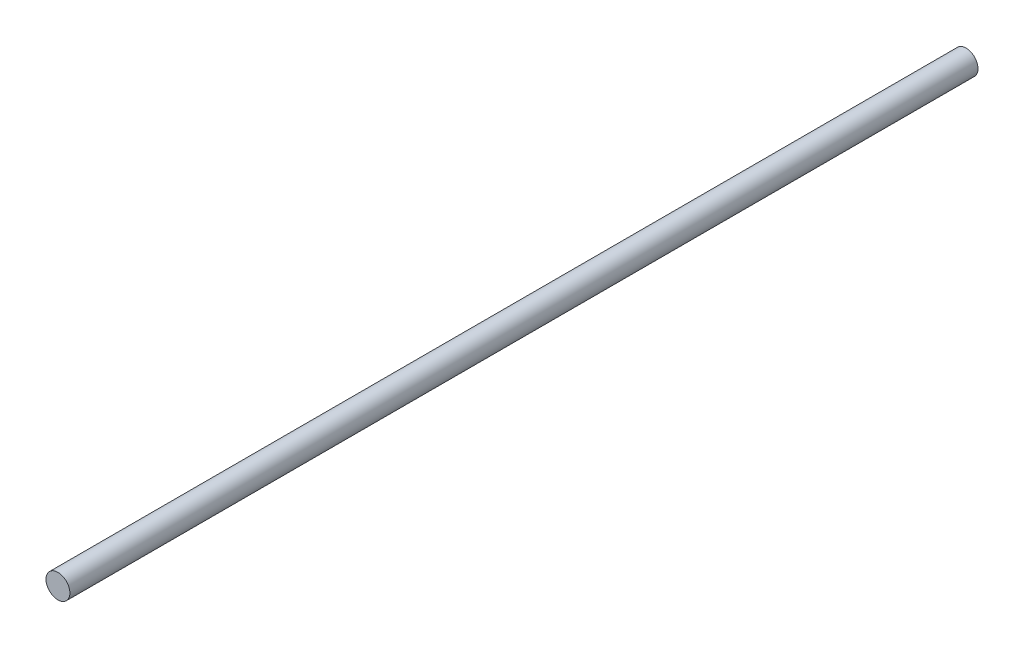
from build123d import *

# Parameters (mm, degrees)
SKETCH1_R           = 2.5
BOSS_EXTRUDE1_DEPTH = 190


with BuildPart() as part:
    # Sketch1 → Boss-Extrude1 (new body)
    with BuildSketch(Plane.XY):
        Circle(SKETCH1_R)
    extrude(amount=BOSS_EXTRUDE1_DEPTH)


solid = part.part
